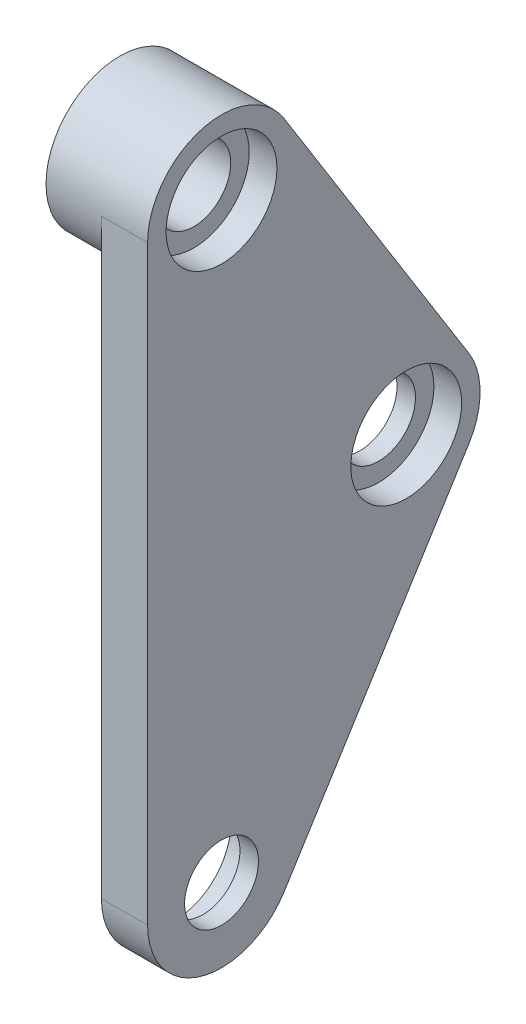
from build123d import *
from build123d.topology import SkipClean

# Parameters (mm, degrees)
EXTRUDE_1_DEPTH          = 2.5
EXTRUDE_START            = -3
SKETCH_1_4_R             = 4
EXTRUDE_2_DEPTH          = 3
CUT_EXTRUDE_1_DEPTH      = 44.965895874
CUT_EXTRUDE_1_DEPTH_BACK = 44.965895874
SKETCH_1_3_R             = 2
SKETCH_2_R               = 3
CUT_EXTRUDE_2_DEPTH      = 1.5
CUT_EXTRUDE_START        = -2.5
SKETCH_2_3_R             = 3
CUT_EXTRUDE_3_DEPTH      = 1.5
SKETCH_3_W               = 20.326782724
SKETCH_3_H               = 52.149860593
CUT_EXTRUDE_4_DEPTH      = 50.297565863


with BuildPart() as part:
    # 草图1 → 凸台-拉伸1 (new body)
    with BuildSketch(Plane(origin=(0, 0, 0), x_dir=(0, 0, -1), z_dir=(1, 0, 0))):
        with BuildLine():
            Line((17.391993216, -17.88000424), (7.391993216, -1.88000424))
            ThreePointArc((7.391993216, -1.88000424), (2.897269948, -0.155005015), (0, -4))
            Line((0, -4), (0, -36))
            ThreePointArc((0, -36), (2.897269948, -39.844994985), (7.391993216, -38.11999576))
            Line((7.391993216, -38.11999576), (17.391993216, -22.11999576))
            ThreePointArc((17.391993216, -22.11999576), (18, -20), (17.391993216, -17.88000424))
        make_face()
    extrude(amount=EXTRUDE_1_DEPTH)

    # 草图1<4> → 凸台-拉伸2 (add)
    with SkipClean():  # the faces are left unmerged after this step: merging them gives an invalid solid
        with BuildSketch(Plane(origin=(0, 0, 0), x_dir=(0, 0, -1), z_dir=(1, 0, 0)).offset(EXTRUDE_START)):
            with Locations(Location((4, -4, 0), (0, 0, 180))):
                Circle(SKETCH_1_4_R)
        extrude(amount=EXTRUDE_2_DEPTH)

    # 草图1<3> → 切除-拉伸1 (cut, two sides: drawn at the far end of the back side and taken through both)
    with SkipClean():  # the faces are left unmerged after this step: merging them gives an invalid solid
        with BuildSketch(Plane(origin=(0, 0, 0), x_dir=(0, 0, -1), z_dir=(1, 0, 0)).offset(-CUT_EXTRUDE_1_DEPTH_BACK)):
            with Locations((4, -4)):
                Circle(SKETCH_1_3_R)
            with Locations((14, -20)):
                Circle(SKETCH_1_3_R)
            with Locations((4, -36)):
                Circle(SKETCH_1_3_R)
        extrude(amount=CUT_EXTRUDE_1_DEPTH + CUT_EXTRUDE_1_DEPTH_BACK, mode=Mode.SUBTRACT)

    # 草图2 → 切除-拉伸2 (cut)
    with SkipClean():  # the faces are left unmerged after this step: merging them gives an invalid solid
        with BuildSketch(Plane(origin=(2.5, 0, 0), x_dir=(0, 0, -1), z_dir=(1, 0, 0))):
            with Locations((4, -4)):
                Circle(SKETCH_2_R)
            with Locations((14, -20)):
                Circle(SKETCH_2_R)
        extrude(amount=-CUT_EXTRUDE_2_DEPTH, mode=Mode.SUBTRACT)

    # 草图2<3> → 切除-拉伸3 (cut)
    with SkipClean():  # the faces are left unmerged after this step: merging them gives an invalid solid
        with BuildSketch(Plane(origin=(2.5, 0, 0), x_dir=(0, 0, -1), z_dir=(1, 0, 0)).offset(CUT_EXTRUDE_START)):
            with Locations((4, -36)):
                Circle(SKETCH_2_3_R)
        extrude(amount=CUT_EXTRUDE_3_DEPTH, mode=Mode.SUBTRACT)


with BuildPart() as body_2:
    # 镜向2: mirrored copy
    add(part.part.mirror(Plane(origin=(-10, 0, 0), x_dir=(0, 0, 1), z_dir=(1, 0, 0))))

    # 草图3 → 切除-拉伸4 (cut, through all)
    with BuildSketch(Plane.XY):
        with Locations((-20.089094384, -20.529857361)):
            Rectangle(SKETCH_3_W, SKETCH_3_H)
    extrude(amount=-CUT_EXTRUDE_4_DEPTH, mode=Mode.SUBTRACT)


solid = part.part
